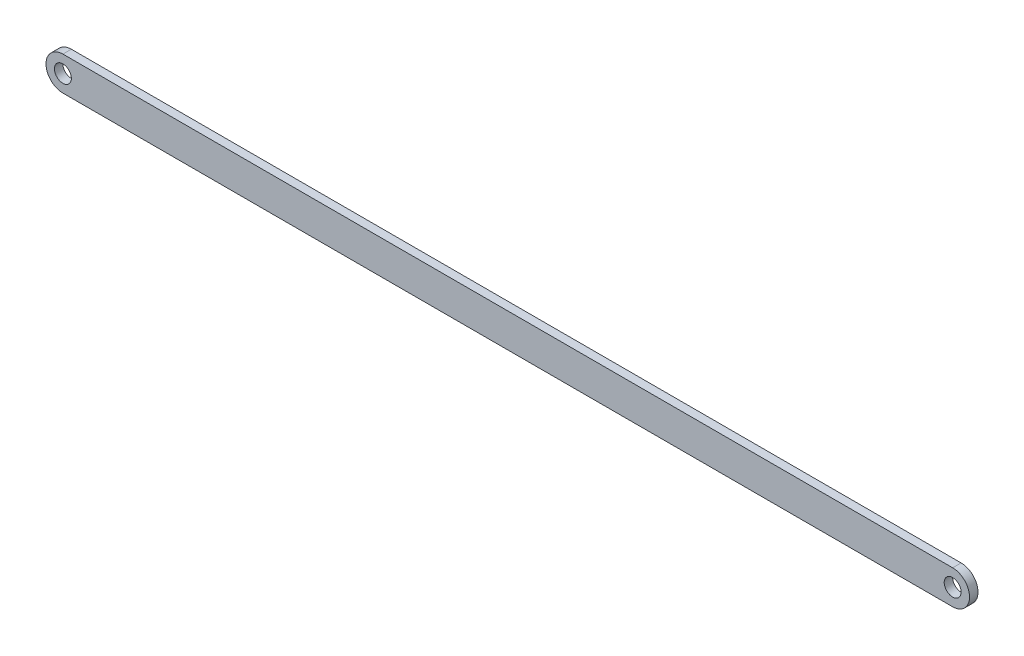
from build123d import *

# Parameters (mm, degrees)
ESBO_O1_R                = 1
RESSALTO_EXTRUS_O1_DEPTH = 1


with BuildPart() as part:
    # Esboço1 → Ressalto-extrusão1 (new body)
    with BuildSketch(Plane.XY):
        with BuildLine():
            Line((-52.66, 2), (52.66, 2))
            ThreePointArc((52.66, 2), (54.66, 0), (52.66, -2))
            Line((52.66, -2), (-52.66, -2))
            ThreePointArc((-52.66, -2), (-54.66, 0), (-52.66, 2))
        make_face()
        with Locations((-52.66, 0)):
            Circle(ESBO_O1_R, mode=Mode.SUBTRACT)
        with Locations((52.66, 0)):
            Circle(ESBO_O1_R, mode=Mode.SUBTRACT)
    extrude(amount=RESSALTO_EXTRUS_O1_DEPTH)


solid = part.part
